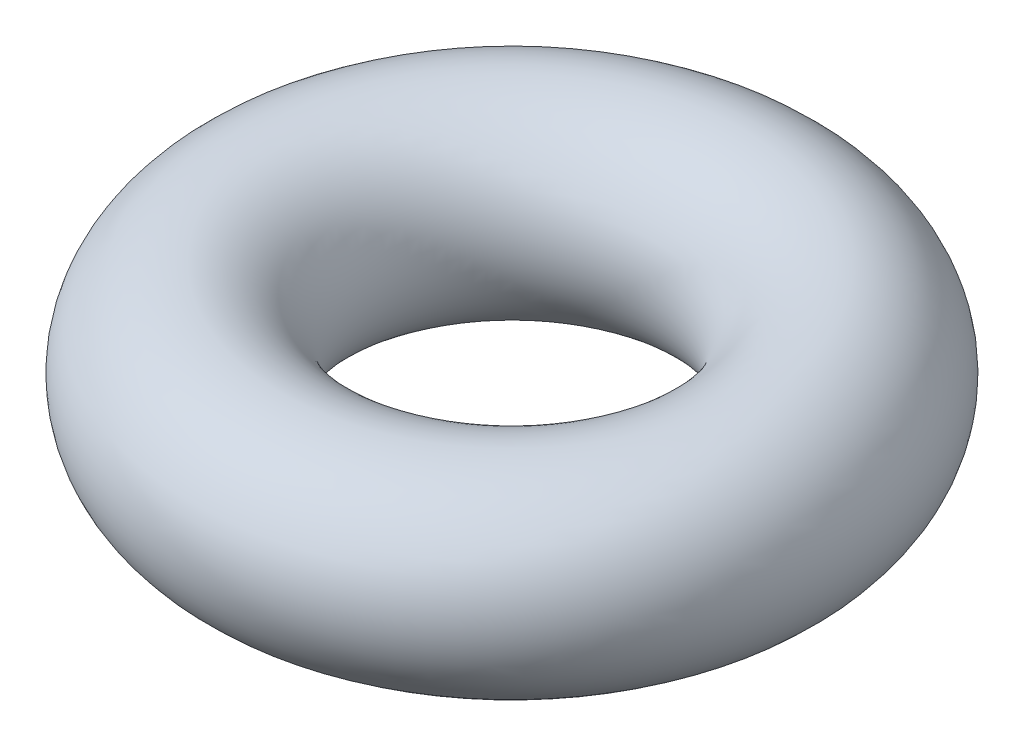
from build123d import *

# Parameters (mm, degrees)
SKETCH_1_R   = 25
SKETCH_1_R_2 = 12.5


with BuildPart() as part:
    # Эскиз1 → Повернуть1 (revolve)
    with BuildSketch(Plane.XY, mode=Mode.PRIVATE) as revolve_1_sk:
        with Locations((-60, 0)):
            Circle(SKETCH_1_R)
        with Locations((-60, 0)):
            Circle(SKETCH_1_R_2, mode=Mode.SUBTRACT)
    revolve(revolve_1_sk.sketch.rotate(Axis((0, 0, 0), (0, 1, 0)), 270), axis=Axis((0, 0, 0), (0, 1, 0)))


solid = part.part
